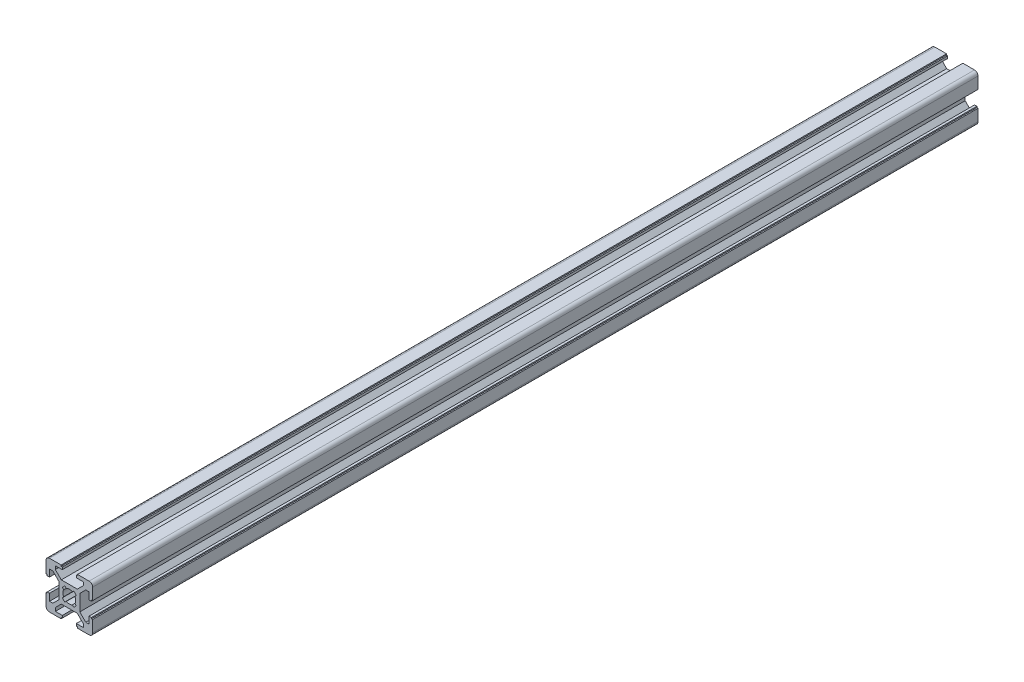
from build123d import *

# Parameters (mm, degrees)
AUFSATZ_LINEAR_AUSTRAGEN1_DEPTH = 380


with BuildPart() as part:
    # Skizze1 → Aufsatz-Linear austragen1 (new body)
    with BuildSketch(Plane.XY):
        with BuildLine():
            Line((9.896623228, -8.686160957), (9.896623228, -3.686160957))
            Line((9.896623228, -3.686160957), (9.396623228, -3.686160957))
            Line((9.396623228, -3.686160957), (9.396623228, -3.186160957))
            Line((9.396623228, -3.186160957), (8.396623228, -3.186160957))
            Line((8.396623228, -3.186160957), (8.396623228, -6.186160957))
            Line((8.396623228, -6.186160957), (6.957283398, -6.186160957))
            Line((6.957283398, -6.186160957), (4.396623228, -3.625500787))
            Line((4.396623228, -3.625500787), (4.396623228, 3.253178873))
            Line((4.396623228, 3.253178873), (6.957283398, 5.813839043))
            Line((6.957283398, 5.813839043), (8.396623228, 5.813839043))
            Line((8.396623228, 5.813839043), (8.396623228, 2.813839043))
            Line((8.396623228, 2.813839043), (9.396623228, 2.813839043))
            Line((9.396623228, 2.813839043), (9.396623228, 3.313839043))
            Line((9.396623228, 3.313839043), (9.896623228, 3.313839043))
            Line((9.896623228, 3.313839043), (9.896623228, 8.313839043))
            ThreePointArc((9.896623228, 8.313839043), (9.457283398, 9.374499213), (8.396623228, 9.813839043))
            Line((8.396623228, 9.813839043), (3.396623228, 9.813839043))
            Line((3.396623228, 9.813839043), (3.396623228, 9.313839043))
            Line((3.396623228, 9.313839043), (2.896623228, 9.313839043))
            Line((2.896623228, 9.313839043), (2.896623228, 8.313839043))
            Line((2.896623228, 8.313839043), (5.896623228, 8.313839043))
            Line((5.896623228, 8.313839043), (5.896623228, 6.874499213))
            Line((5.896623228, 6.874499213), (3.335963058, 4.313839043))
            Line((3.335963058, 4.313839043), (-3.542716602, 4.313839043))
            Line((-3.542716602, 4.313839043), (-6.103376772, 6.874499213))
            Line((-6.103376772, 6.874499213), (-6.103376772, 8.313839043))
            Line((-6.103376772, 8.313839043), (-3.103376772, 8.313839043))
            Line((-3.103376772, 8.313839043), (-3.103376772, 9.313839043))
            Line((-3.103376772, 9.313839043), (-3.603376772, 9.313839043))
            Line((-3.603376772, 9.313839043), (-3.603376772, 9.813839043))
            Line((-3.603376772, 9.813839043), (-8.603376772, 9.813839043))
            ThreePointArc((-8.603376772, 9.813839043), (-9.664036942, 9.374499213), (-10.103376772, 8.313839043))
            Line((-10.103376772, 8.313839043), (-10.103376772, 3.313839043))
            Line((-10.103376772, 3.313839043), (-9.603376772, 3.313839043))
            Line((-9.603376772, 3.313839043), (-9.603376772, 2.813839043))
            Line((-9.603376772, 2.813839043), (-8.603376772, 2.813839043))
            Line((-8.603376772, 2.813839043), (-8.603376772, 5.813839043))
            Line((-8.603376772, 5.813839043), (-7.164036942, 5.813839043))
            Line((-7.164036942, 5.813839043), (-4.603376772, 3.253178873))
            Line((-4.603376772, 3.253178873), (-4.603376772, -3.625500787))
            Line((-4.603376772, -3.625500787), (-7.164036942, -6.186160957))
            Line((-7.164036942, -6.186160957), (-8.603376772, -6.186160957))
            Line((-8.603376772, -6.186160957), (-8.603376772, -3.186160957))
            Line((-8.603376772, -3.186160957), (-9.603376772, -3.186160957))
            Line((-9.603376772, -3.186160957), (-9.603376772, -3.686160957))
            Line((-9.603376772, -3.686160957), (-10.103376772, -3.686160957))
            Line((-10.103376772, -3.686160957), (-10.103376772, -8.686160957))
            ThreePointArc((-10.103376772, -8.686160957), (-9.664036942, -9.746821127), (-8.603376772, -10.186160957))
            Line((-8.603376772, -10.186160957), (-3.603376772, -10.186160957))
            Line((-3.603376772, -10.186160957), (-3.603376772, -9.686160957))
            Line((-3.603376772, -9.686160957), (-3.103376772, -9.686160957))
            Line((-3.103376772, -9.686160957), (-3.103376772, -8.686160957))
            Line((-3.103376772, -8.686160957), (-6.103376772, -8.686160957))
            Line((-6.103376772, -8.686160957), (-6.103376772, -7.246821127))
            Line((-6.103376772, -7.246821127), (-3.542716602, -4.686160957))
            Line((-3.542716602, -4.686160957), (3.335963058, -4.686160957))
            Line((3.335963058, -4.686160957), (5.896623228, -7.246821127))
            Line((5.896623228, -7.246821127), (5.896623228, -8.686160957))
            Line((5.896623228, -8.686160957), (2.896623228, -8.686160957))
            Line((2.896623228, -8.686160957), (2.896623228, -9.686160957))
            Line((2.896623228, -9.686160957), (3.396623228, -9.686160957))
            Line((3.396623228, -9.686160957), (3.396623228, -10.186160957))
            Line((3.396623228, -10.186160957), (8.396623228, -10.186160957))
            ThreePointArc((8.396623228, -10.186160957), (9.457283398, -9.746821127), (9.896623228, -8.686160957))
        make_face()
        with BuildLine():
            Line((-2.539013132, 1.090622313), (-3.103550972, 1.763412313))
            Line((-3.103550972, 1.763412313), (-2.052950042, 2.814013243))
            Line((-2.052950042, 2.814013243), (-1.380160042, 2.249475403))
            ThreePointArc((-1.380160042, 2.249475403), (-0.103376772, 2.563839041), (1.173406498, 2.249475399))
            Line((1.173406498, 2.249475399), (1.846196498, 2.814013239))
            Line((1.846196498, 2.814013239), (2.896797428, 1.763412309))
            Line((2.896797428, 1.763412309), (2.332259586, 1.09062231))
            ThreePointArc((2.332259586, 1.09062231), (2.646623225, -0.186160958), (2.332259587, -1.462944226))
            Line((2.332259587, -1.462944226), (2.896797427, -2.135734226))
            Line((2.896797427, -2.135734226), (1.846196497, -3.186335156))
            Line((1.846196497, -3.186335156), (1.173406497, -2.621797316))
            ThreePointArc((1.173406497, -2.621797316), (-0.103376773, -2.936160957), (-1.380160043, -2.62179732))
            Line((-1.380160043, -2.62179732), (-2.052950043, -3.18633516))
            Line((-2.052950043, -3.18633516), (-3.103550973, -2.13573423))
            Line((-3.103550973, -2.13573423), (-2.539013133, -1.46294423))
            ThreePointArc((-2.539013133, -1.46294423), (-2.853376773, -0.186160958), (-2.539013132, 1.090622313))
        make_face(mode=Mode.SUBTRACT)
    extrude(amount=AUFSATZ_LINEAR_AUSTRAGEN1_DEPTH)


solid = part.part
